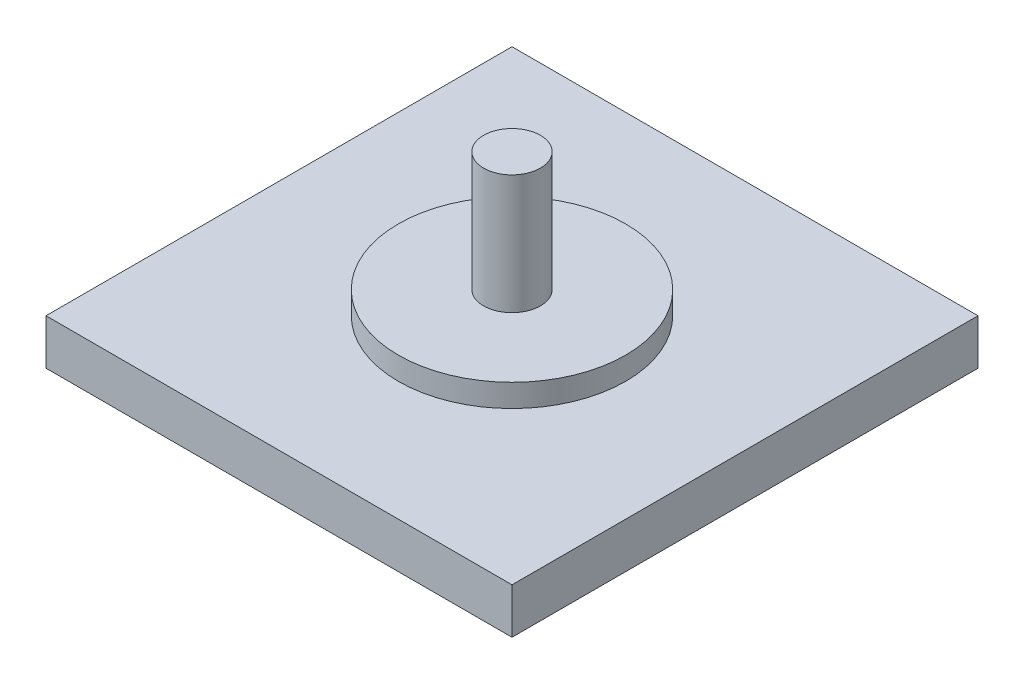
from build123d import *

# Parameters (mm, degrees)
SKETCH_1_W      = 41
SKETCH_1_H      = 41
EXTRUDE_1_DEPTH = 4
SKETCH_2_R      = 10
EXTRUDE_2_DEPTH = 2
SKETCH_3_R      = 2.5
EXTRUDE_3_DEPTH = 10.5


with BuildPart() as part:
    # 草图1 → 凸台-拉伸1 (new body)
    with BuildSketch(Plane(origin=(0, 0, 0), x_dir=(1, 0, 0), z_dir=(0, 1, 0))):
        Rectangle(SKETCH_1_W, SKETCH_1_H)
    extrude(amount=EXTRUDE_1_DEPTH)

    # 草图2 → 凸台-拉伸2 (add)
    with BuildSketch(Plane(origin=(0, 4, 0), x_dir=(1, 0, 0), z_dir=(0, 1, 0))):
        with Locations(Location((0, 0, 0), (0, 0, 270))):
            Circle(SKETCH_2_R)
    extrude(amount=EXTRUDE_2_DEPTH)

    # 草图3 → 凸台-拉伸3 (add)
    with BuildSketch(Plane(origin=(0, 6, 0), x_dir=(1, 0, 0), z_dir=(0, 1, 0))):
        with Locations(Location((0, 0, 0), (0, 0, 90))):
            Circle(SKETCH_3_R)
    extrude(amount=EXTRUDE_3_DEPTH)


solid = part.part
